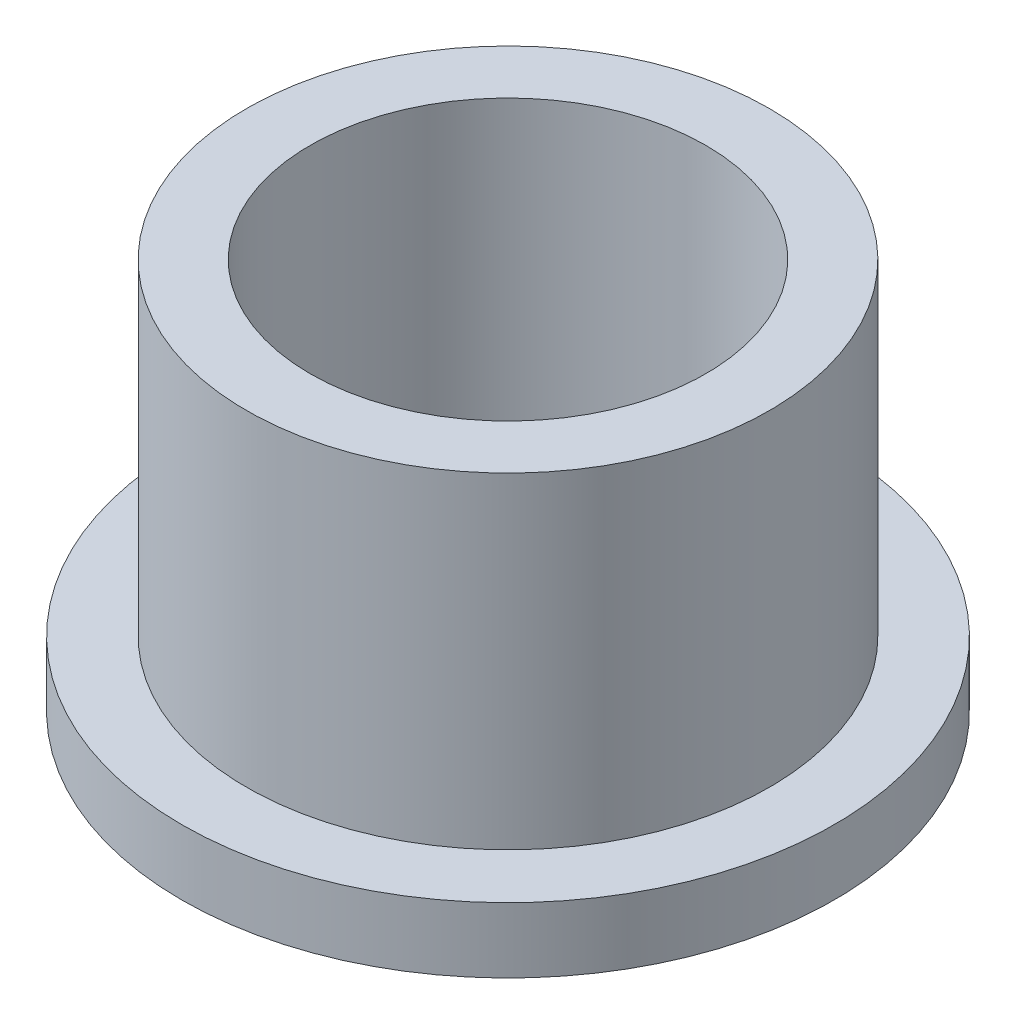
from build123d import *

# Parameters (mm, degrees)
SKETCH2_R           = 6.3627
SKETCH2_R_2         = 4.8133
BOSS_EXTRUDE1_DEPTH = 9.525
SKETCH3_R           = 7.9375
SKETCH3_R_2         = 6.3627
BOSS_EXTRUDE2_DEPTH = 1.5875


with BuildPart() as part:
    # Sketch2 → Boss-Extrude1 (new body)
    with BuildSketch(Plane(origin=(0, 0, 0), x_dir=(1, 0, 0), z_dir=(0, 1, 0))):
        with Locations(Location((0, 0, 0), (0, 0, 90))):
            Circle(SKETCH2_R)
        with Locations(Location((0, 0, 0), (0, 0, 90))):
            Circle(SKETCH2_R_2, mode=Mode.SUBTRACT)
    extrude(amount=BOSS_EXTRUDE1_DEPTH)

    # Sketch3 → Boss-Extrude2 (add)
    with BuildSketch(Plane(origin=(0, 0, 0), x_dir=(1, 0, 0), z_dir=(0, 1, 0))):
        with Locations(Location((0, 0, 0), (0, 0, 270))):
            Circle(SKETCH3_R)
        with Locations(Location((0, 0, 0), (0, 0, 90))):
            Circle(SKETCH3_R_2, mode=Mode.SUBTRACT)
    extrude(amount=BOSS_EXTRUDE2_DEPTH)


solid = part.part
